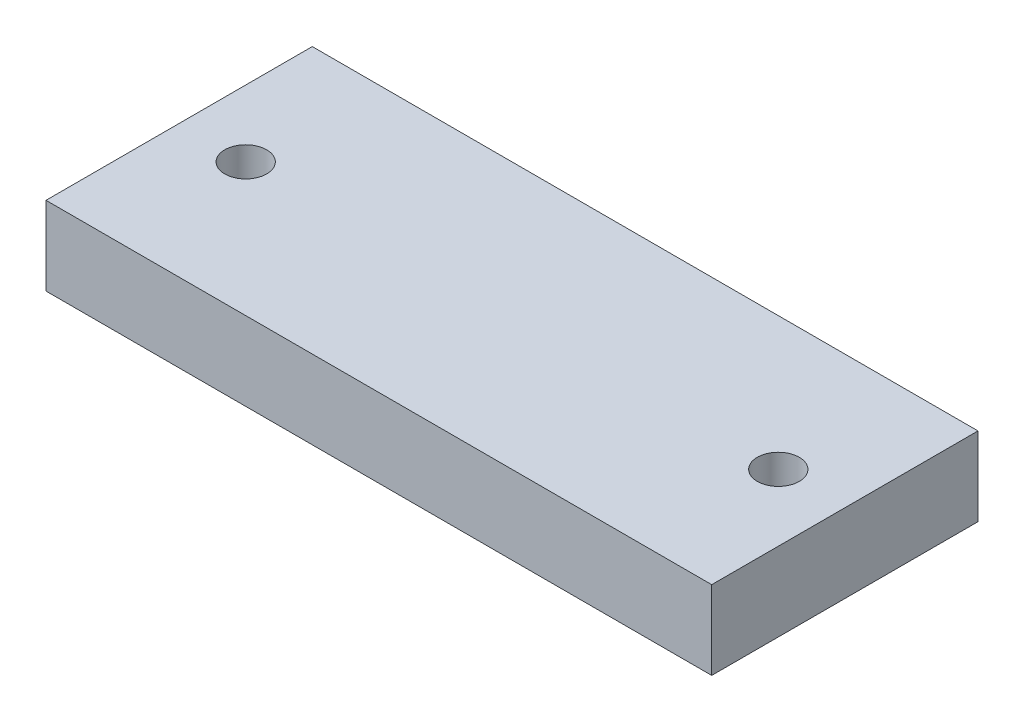
from build123d import *

# Parameters (mm, degrees)
SKETCH_1_W      = 127
SKETCH_1_H      = 50.8
SKETCH_1_R      = 4
EXTRUDE_1_DEPTH = 15


with BuildPart() as part:
    # 草图1 → 凸台-拉伸1 (new body)
    with BuildSketch(Plane(origin=(0, 0, 0), x_dir=(1, 0, 0), z_dir=(0, 1, 0))):
        with Locations((63.5, -25.4)):
            Rectangle(SKETCH_1_W, SKETCH_1_H)
        with Locations(Location((12.7, -25.4, 0), (0, 0, 270))):
            Circle(SKETCH_1_R, mode=Mode.SUBTRACT)
        with Locations(Location((114.3, -25.4, 0), (0, 0, 270))):
            Circle(SKETCH_1_R, mode=Mode.SUBTRACT)
    extrude(amount=EXTRUDE_1_DEPTH)


solid = part.part
